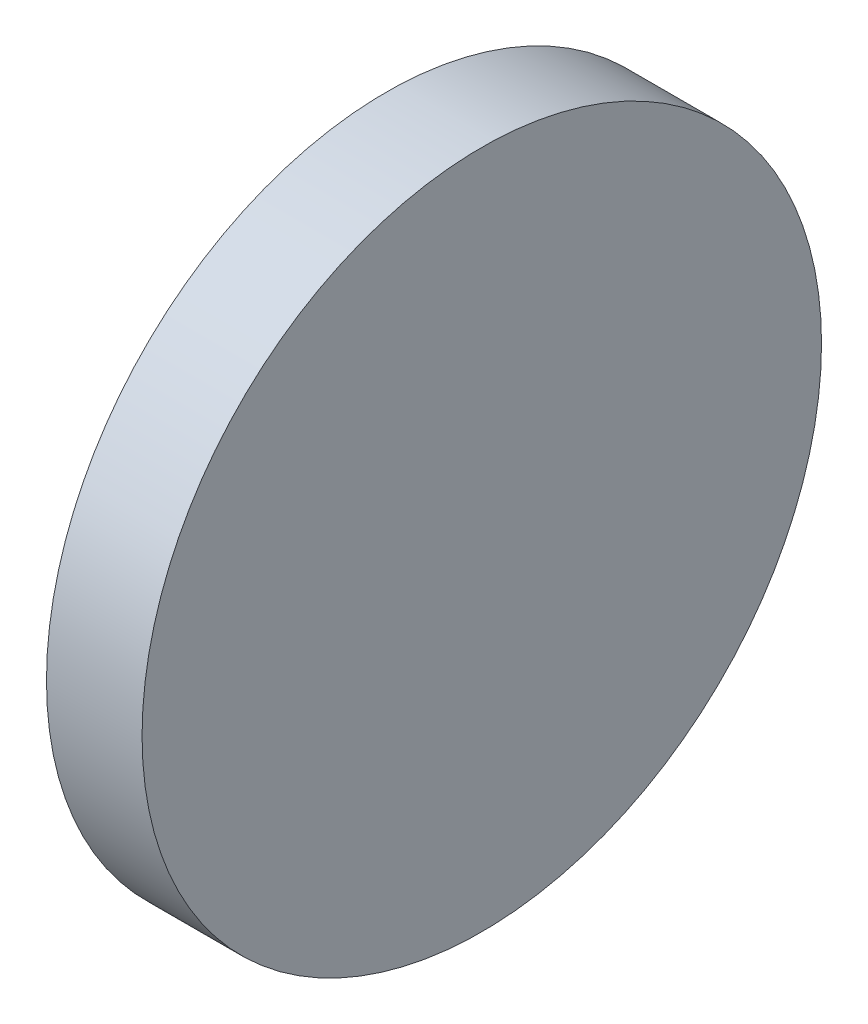
from build123d import *

# Parameters (mm, degrees)
ESQUISSE1_W = 2.11
ESQUISSE1_H = 7.5


with BuildPart() as part:
    # Esquisse1 → Révolution1 (revolve)
    with BuildSketch(Plane.XY, mode=Mode.PRIVATE) as r_volution1_sk:
        with Locations((0, 3.75)):
            Rectangle(ESQUISSE1_W, ESQUISSE1_H)
    revolve(r_volution1_sk.sketch.rotate(Axis((-1.055, 0, 0), (1, 0, 0)), 90), axis=Axis((-1.055, 0, 0), (1, 0, 0)))


solid = part.part
